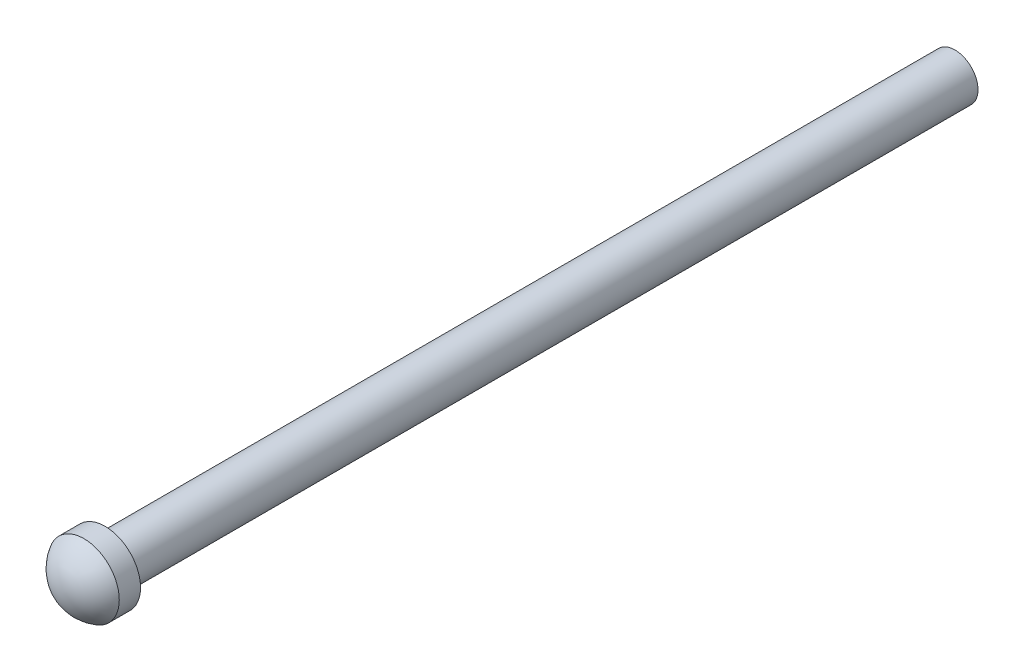
from build123d import *

# Parameters (mm, degrees)
SKETCH_1_R         = 3.25
SKETCH_3_R         = 5
EXTRUDE_1_DEPTH    = 3
DOME_1_FACE_RADIUS = 5
DOME_1_HEIGHT      = 3


with BuildPart() as part:
    # 扫描1: sweep along a path in 草图2
    with BuildLine(Plane(origin=(0, 0, 0), x_dir=(0, 0, -1), z_dir=(1, 0, 0))) as sweep_1_path:
        Line((0, 0), (120, 0))
    # 草图1 → 扫描1 (sweep)
    with BuildSketch(Plane.XY):
        with Locations((5, 60)):
            Circle(SKETCH_1_R)
    sweep(path=sweep_1_path.line)

    # 草图3 → 凸台-拉伸1 (add)
    with BuildSketch(Plane.XY):
        with Locations((5, 60)):
            Circle(SKETCH_3_R)
    extrude(amount=EXTRUDE_1_DEPTH)

    # 圆顶1: a dome of height H over a round flat face of radius A is a cap of a sphere of radius (A * A + H * H) / (2 * H)
    dome_1_r = (DOME_1_FACE_RADIUS * DOME_1_FACE_RADIUS + DOME_1_HEIGHT * DOME_1_HEIGHT) / (2 * DOME_1_HEIGHT)
    dome_1_base = Plane((5, 60, 3), z_dir=(0, 0, 1))
    with Locations(dome_1_base.offset(DOME_1_HEIGHT - dome_1_r)):
        dome_1_ball = Sphere(dome_1_r, mode=Mode.PRIVATE)
    add(split(dome_1_ball, bisect_by=dome_1_base, keep=Keep.TOP, mode=Mode.PRIVATE))


solid = part.part
